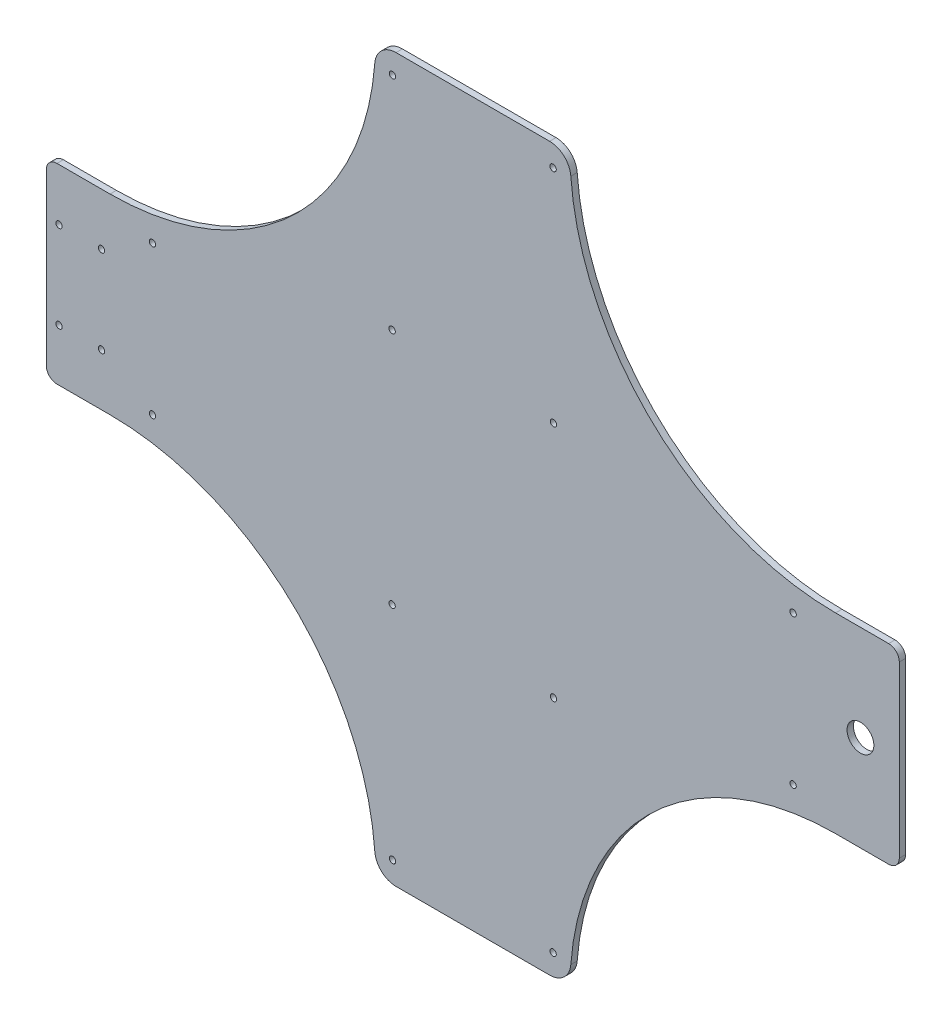
from build123d import *

# Parameters (mm, degrees)
EXTRUDE_1_DEPTH      = 3
SKETCH_4_R           = 1.5
CUT_EXTRUDE_2_DEPTH  = 10
SKETCH_5_R           = 1.5
CUT_EXTRUDE_3_DEPTH  = 10
FILLET_1_R           = 5
SKETCH_6_W           = 116.747996977
SKETCH_6_H           = 25
SKETCH_6_W_2         = 124.073590325
SKETCH_6_W_3         = 98.220869454
SKETCH_6_W_4         = 117.634329044
CUT_EXTRUDE_4_DEPTH  = 10
SKETCH_7_W           = 65
SKETCH_7_H           = 110
CUT_EXTRUDE_5_DEPTH  = 10
FILLET_2_R           = 5
FILLET_3_R           = 5
SKETCH_9_R           = 6.308122895
CUT_EXTRUDE_7_DEPTH  = 10
SKETCH_10_R          = 1.5
CUT_EXTRUDE_8_DEPTH  = 10
SKETCH_11_R          = 1.5
CUT_EXTRUDE_9_DEPTH  = 10
SKETCH_12_W          = 120.586074841
SKETCH_12_H          = 63.347236109
SKETCH_12_W_2        = 131.774283424
SKETCH_12_H_2        = 66.604431946
CUT_EXTRUDE_10_DEPTH = 10
FILLET_4_R           = 10


with BuildPart() as part:
    # 草图2 → 凸台-拉伸1 (new body)
    with BuildSketch(Plane.XY):
        with BuildLine():
            Line((-16.583123952, 25), (0, 25))
            Line((0, 25), (0, 55))
            Line((0, 55), (91.6, 55))
            Line((91.6, 55), (91.6, 25))
            Line((91.6, 25), (108.183123952, 25))
            Line((108.183123952, 25), (188.183123952, 25))
            Line((188.183123952, 25), (188.183123952, 0))
            Line((188.183123952, 0), (91.6, 0))
            ThreePointArc((91.6, 0), (128.211652352, -88.388347648), (216.6, -125))
            Line((216.6, -125), (246.6, -125))
            Line((246.6, -125), (246.6, -215))
            Line((246.6, -215), (216.6, -215))
            ThreePointArc((216.6, -215), (128.211652352, -251.611652352), (91.6, -340))
            Line((91.6, -340), (188.183123952, -340))
            Line((188.183123952, -340), (188.183123952, -365))
            Line((188.183123952, -365), (108.183123952, -365))
            Line((108.183123952, -365), (91.6, -365))
            Line((91.6, -365), (91.6, -395))
            Line((91.6, -395), (0, -395))
            Line((0, -395), (0, -365))
            Line((0, -365), (-16.583123952, -365))
            Line((-16.583123952, -365), (-96.583123952, -365))
            Line((-96.583123952, -365), (-96.583123952, -340))
            Line((-96.583123952, -340), (0, -340))
            ThreePointArc((0, -340), (-36.611652352, -251.611652352), (-125, -215))
            Line((-125, -215), (-155, -215))
            Line((-155, -215), (-155, -125))
            Line((-155, -125), (-125, -125))
            ThreePointArc((-125, -125), (-36.611652352, -88.388347648), (0, 0))
            Line((0, 0), (-96.583123952, 0))
            Line((-96.583123952, 0), (-96.583123952, 25))
            Line((-96.583123952, 25), (-16.583123952, 25))
        make_face()
    extrude(amount=EXTRUDE_1_DEPTH)

    # 草图4 → 切除-拉伸2 (cut)
    with BuildSketch(Plane.XY.offset(3)):
        with Locations((-90.583123952, 20)):
            Circle(SKETCH_4_R)
        with Locations(Location((-90.583123952, 5, 0), (0, 0, 180))):
            Circle(SKETCH_4_R)
        with Locations((-90.583123952, -345)):
            Circle(SKETCH_4_R)
        with Locations(Location((-90.583123952, -360, 0), (0, 0, 180))):
            Circle(SKETCH_4_R)
        with Locations((182.183123952, -360)):
            Circle(SKETCH_4_R)
        with Locations(Location((182.183123952, -345, 0), (0, 0, 180))):
            Circle(SKETCH_4_R)
        with Locations((182.183123952, 5)):
            Circle(SKETCH_4_R)
        with Locations(Location((182.183123952, 20, 0), (0, 0, 180))):
            Circle(SKETCH_4_R)
    extrude(amount=-CUT_EXTRUDE_2_DEPTH, mode=Mode.SUBTRACT)

    # 草图5 → 切除-拉伸3 (cut)
    with BuildSketch(Plane.XY.offset(3)):
        with Locations((8, -10)):
            Circle(SKETCH_5_R)
        with Locations(Location((83.6, -10, 0), (0, 0, 180))):
            Circle(SKETCH_5_R)
        with Locations((83.6, -330)):
            Circle(SKETCH_5_R)
        with Locations(Location((8, -330, 0), (0, 0, 180))):
            Circle(SKETCH_5_R)
        with Locations((196.6, -135)):
            Circle(SKETCH_5_R)
        with Locations(Location((196.6, -205, 0), (0, 0, 180))):
            Circle(SKETCH_5_R)
        with Locations((-105, -205)):
            Circle(SKETCH_5_R)
        with Locations(Location((-105, -135, 0), (0, 0, 180))):
            Circle(SKETCH_5_R)
    extrude(amount=-CUT_EXTRUDE_3_DEPTH, mode=Mode.SUBTRACT)

    # 圆角1
    fillet_1_edges = [part.edges().sort_by_distance(p)[0] for p in [
        (-96.583123952, 0, 1.5),
        (-96.583123952, 25, 1.5),
        (0, 55, 1.5),
        (91.6, 55, 1.5),
        (188.183123952, 25, 1.5),
        (188.183123952, 0, 1.5),
        (246.6, -125, 1.5),
        (246.6, -215, 1.5),
        (188.183123952, -340, 1.5),
        (188.183123952, -365, 1.5),
        (91.6, -395, 1.5),
        (0, -395, 1.5),
        (-96.583123952, -365, 1.5),
        (-96.583123952, -340, 1.5),
        (-155, -215, 1.5),
        (-155, -125, 1.5),
    ]]
    fillet(fillet_1_edges, radius=FILLET_1_R)

    # 草图6 → 切除-拉伸4 (cut)
    with BuildSketch(Plane.XY.offset(3)):
        with Locations((-58.373998489, 12.5)):
            Rectangle(SKETCH_6_W, SKETCH_6_H)
        with Locations((153.636795163, 12.5)):
            Rectangle(SKETCH_6_W_2, SKETCH_6_H)
        with Locations((-49.110434727, -352.5)):
            Rectangle(SKETCH_6_W_3, SKETCH_6_H)
        with Locations((150.417164522, -352.5)):
            Rectangle(SKETCH_6_W_4, SKETCH_6_H)
    extrude(amount=-CUT_EXTRUDE_4_DEPTH, mode=Mode.SUBTRACT)

    # 草图7 → 切除-拉伸5 (cut)
    with BuildSketch(Plane.XY.offset(3)):
        with Locations((45.8, 55)):
            Rectangle(SKETCH_7_W, SKETCH_7_H)
        with Locations((45.8, -395)):
            Rectangle(SKETCH_7_W, SKETCH_7_H)
    extrude(amount=-CUT_EXTRUDE_5_DEPTH, mode=Mode.SUBTRACT)

    # 圆角2
    fillet_2_edges = [part.edges().sort_by_distance(p)[0] for p in [
        (13.3, 55, 1.5),
        (78.3, 55, 1.5),
        (78.3, -395, 1.5),
        (13.3, -395, 1.5),
    ]]
    fillet(fillet_2_edges, radius=FILLET_2_R)

    # 圆角3
    fillet_3_edges = [part.edges().sort_by_distance(p)[0] for p in [
        (13.3, 0, 1.5),
        (78.3, 0, 1.5),
        (78.3, -340, 1.5),
        (13.3, -340, 1.5),
    ]]
    fillet(fillet_3_edges, radius=FILLET_3_R)

    # 草图9 → 切除-拉伸7 (cut)
    with BuildSketch(Plane.XY.offset(3)):
        with Locations((228.308745857, -170)):
            Circle(SKETCH_9_R)
    extrude(amount=-CUT_EXTRUDE_7_DEPTH, mode=Mode.SUBTRACT)

    # 草图10 → 切除-拉伸8 (cut)
    with BuildSketch(Plane.XY.offset(3)):
        with Locations((-149, -149.5)):
            Circle(SKETCH_10_R)
        with Locations((-129, -149.5)):
            Circle(SKETCH_10_R)
        with Locations((-149, -190.5)):
            Circle(SKETCH_10_R)
        with Locations((-129, -190.5)):
            Circle(SKETCH_10_R)
    extrude(amount=-CUT_EXTRUDE_8_DEPTH, mode=Mode.SUBTRACT)

    # 草图11 → 切除-拉伸9 (cut)
    with BuildSketch(Plane.XY.offset(3)):
        with Locations((7.8, -114)):
            Circle(SKETCH_11_R)
        with Locations((83.8, -114)):
            Circle(SKETCH_11_R)
        with Locations((83.8, -226)):
            Circle(SKETCH_11_R)
        with Locations((7.8, -226)):
            Circle(SKETCH_11_R)
    extrude(amount=-CUT_EXTRUDE_9_DEPTH, mode=Mode.SUBTRACT)

    # 草图12 → 切除-拉伸10 (cut)
    with BuildSketch(Plane.XY.offset(3)):
        with Locations((60.293037421, 31.673618055)):
            Rectangle(SKETCH_12_W, SKETCH_12_H)
        with Locations((65.887141712, -373.302215973)):
            Rectangle(SKETCH_12_W_2, SKETCH_12_H_2)
    extrude(amount=-CUT_EXTRUDE_10_DEPTH, mode=Mode.SUBTRACT)

    # 圆角4
    fillet_4_edges = [part.edges().sort_by_distance(p)[0] for p in [
        (0, 0, 1.5),
        (91.6, 0, 1.5),
        (91.6, -340, 1.5),
        (0, -340, 1.5),
    ]]
    fillet(fillet_4_edges, radius=FILLET_4_R)


solid = part.part
